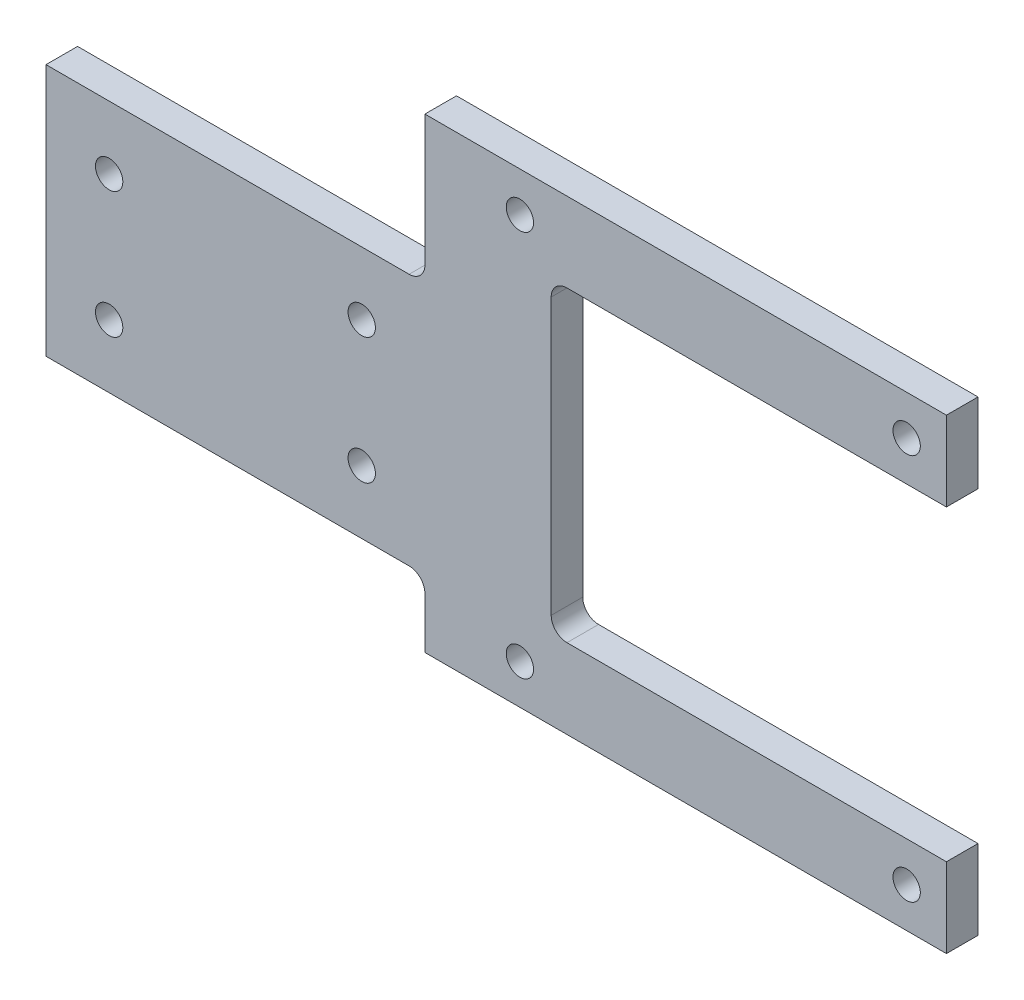
from build123d import *

# Parameters (mm, degrees)
BOSS_EXTRUDE1_DEPTH      = 6.35
M5_CLEARANCE_HOLE1_D     = 5.5
M5_CLEARANCE_HOLE1_DEPTH = 18.75
M5_CLEARANCE_HOLE1_TIP   = 1.652366702
FILLET1_R                = 3.175
M5_CLEARANCE_HOLE2_D     = 5.5
M5_CLEARANCE_HOLE2_DEPTH = 18.75
M5_CLEARANCE_HOLE2_TIP   = 1.652366702


with BuildPart() as part:
    # Sketch1 → Boss-Extrude1 (new body)
    with BuildSketch(Plane.XY):
        Polygon((38.1, 25.4), (38.1, 54.890872965), (142.990872965, 54.890872965), (142.990872965, 38.890872965), (63.5, 38.890872965), (63.5, -22.890872965), (142.990872965, -22.890872965), (142.990872965, -38.890872965), (38.1, -38.890872965), (38.1, -25.4), (-38.1, -25.4), (-38.1, 25.4), align=None)
    extrude(amount=BOSS_EXTRUDE1_DEPTH)

    # M5 Clearance Hole1
    with Locations(Plane.XY.offset(6.35)):
        with Locations((134.990872965, 46.890872965), (134.990872965, -30.890872965), (57.209127035, 46.890872965), (57.209127035, -30.890872965)):
            Hole(M5_CLEARANCE_HOLE1_D / 2, depth=M5_CLEARANCE_HOLE1_DEPTH)
            with Locations((0, 0, -(M5_CLEARANCE_HOLE1_DEPTH + M5_CLEARANCE_HOLE1_TIP / 2))):  # 118° drill point
                Cone(0, M5_CLEARANCE_HOLE1_D / 2, M5_CLEARANCE_HOLE1_TIP, mode=Mode.SUBTRACT)

    # Fillet1
    fillet1_edges = [part.edges().sort_by_distance(p)[0] for p in [
        (38.1, 25.4, 3.175),
        (63.5, 38.890872965, 3.175),
        (63.5, -22.890872965, 3.175),
        (38.1, -25.4, 3.175),
    ]]
    fillet(fillet1_edges, radius=FILLET1_R)

    # M5 Clearance Hole2
    with Locations(Plane.XY.offset(6.35)):
        with Locations((-25.4, 12.7), (25.4, 12.7), (25.4, -12.7), (-25.4, -12.7)):
            Hole(M5_CLEARANCE_HOLE2_D / 2, depth=M5_CLEARANCE_HOLE2_DEPTH)
            with Locations((0, 0, -(M5_CLEARANCE_HOLE2_DEPTH + M5_CLEARANCE_HOLE2_TIP / 2))):  # 118° drill point
                Cone(0, M5_CLEARANCE_HOLE2_D / 2, M5_CLEARANCE_HOLE2_TIP, mode=Mode.SUBTRACT)


solid = part.part
